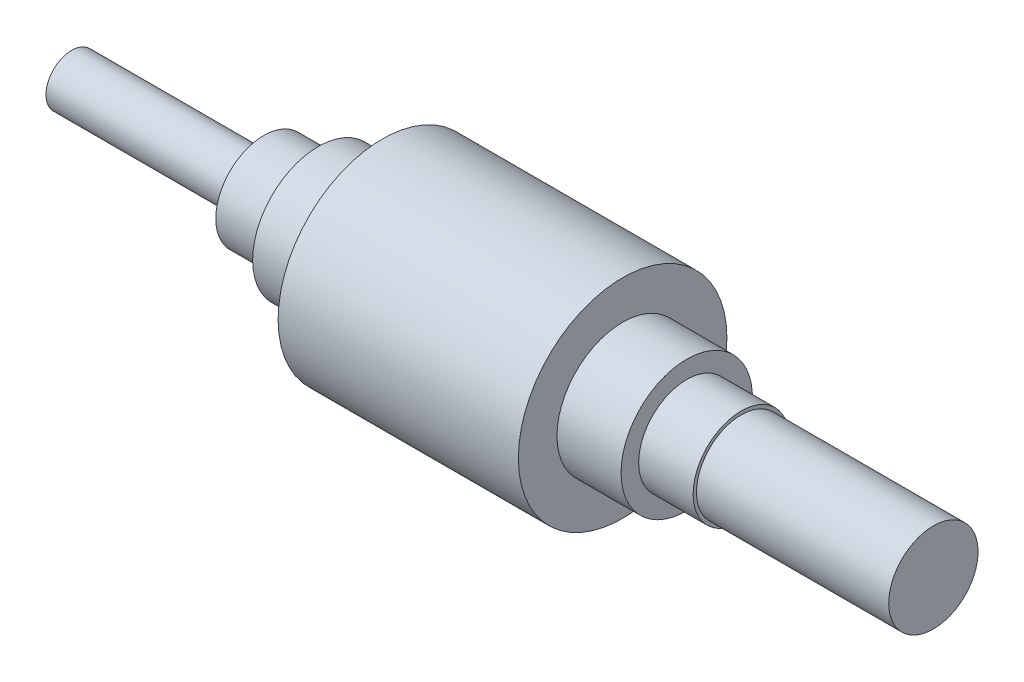
from build123d import *


with BuildPart() as part:
    # Çizim1 → Döndür1 (revolve)
    with BuildSketch(Plane.XY, mode=Mode.PRIVATE) as d_nd_r1_sk:
        Polygon((30, 7.5), (38.5, 7.5), (38.5, 10.25), (48.5, 10.25), (48.5, 16.275), (86, 16.275), (86, 10.25), (96, 10.25), (96, 7.5), (104.5, 7.5), (104.5, 6.975), (134.5, 6.975), (134.5, 0), (0, 0), (0, 4), (30, 4), align=None)
    revolve(d_nd_r1_sk.sketch.rotate(Axis((0, 0, 0), (1, 0, 0)), 90), axis=Axis((0, 0, 0), (1, 0, 0)))


solid = part.part
